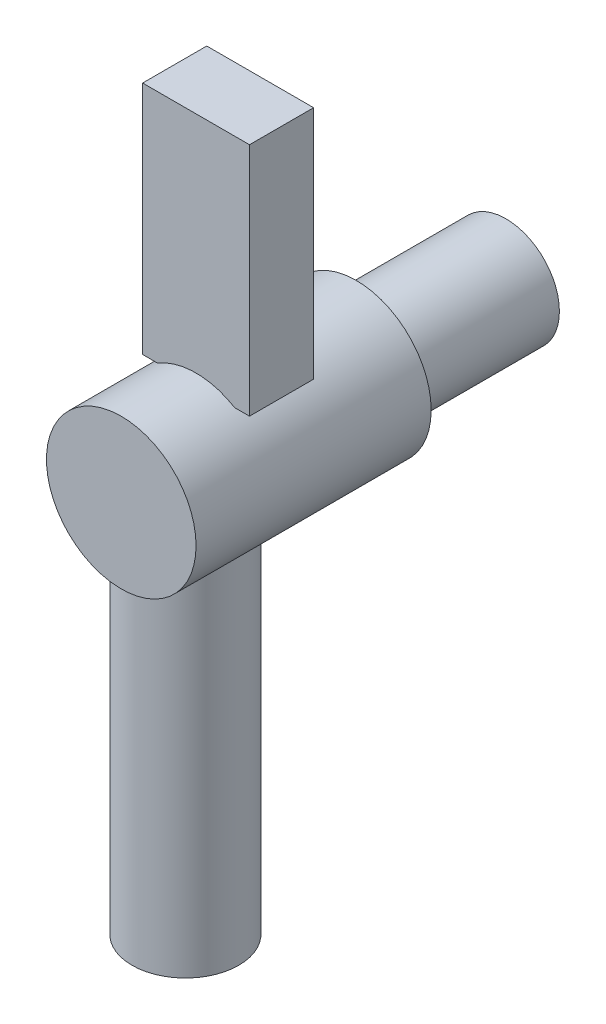
from build123d import *

# Parameters (mm, degrees)
SKETCH1_R    = 5
SPIGOT_DEPTH = 14
BODY_START   = 14
SKETCH2_R    = 7
BODY_DEPTH   = 22
SPOUT_START  = -38
SKETCH3_R    = 5
SPOUT_DEPTH  = 38
LEVER_START  = 6
SKETCH4_W    = 10
SKETCH4_H    = 6
LEVER_DEPTH  = 22


with BuildPart() as part:
    # Sketch1 → Spigot (new body)
    with BuildSketch(Plane.XY):
        Circle(SKETCH1_R)
    extrude(amount=SPIGOT_DEPTH)

    # Sketch2 → Body (add)
    with BuildSketch(Plane.XY.offset(BODY_START)):
        Circle(SKETCH2_R)
    extrude(amount=BODY_DEPTH)

    # Sketch3 → Spout (add)
    with BuildSketch(Plane(origin=(0, 0, 0), x_dir=(1, 0, 0), z_dir=(0, 1, 0)).offset(SPOUT_START)):
        with Locations(Location((0, -30, 0), (0, 0, 90))):
            Circle(SKETCH3_R)
    extrude(amount=SPOUT_DEPTH)

    # Sketch4 → Lever (add)
    with BuildSketch(Plane(origin=(0, 0, 0), x_dir=(1, 0, 0), z_dir=(0, 1, 0)).offset(LEVER_START)):
        with Locations((0, -26)):
            Rectangle(SKETCH4_W, SKETCH4_H)
    extrude(amount=LEVER_DEPTH)


solid = part.part
